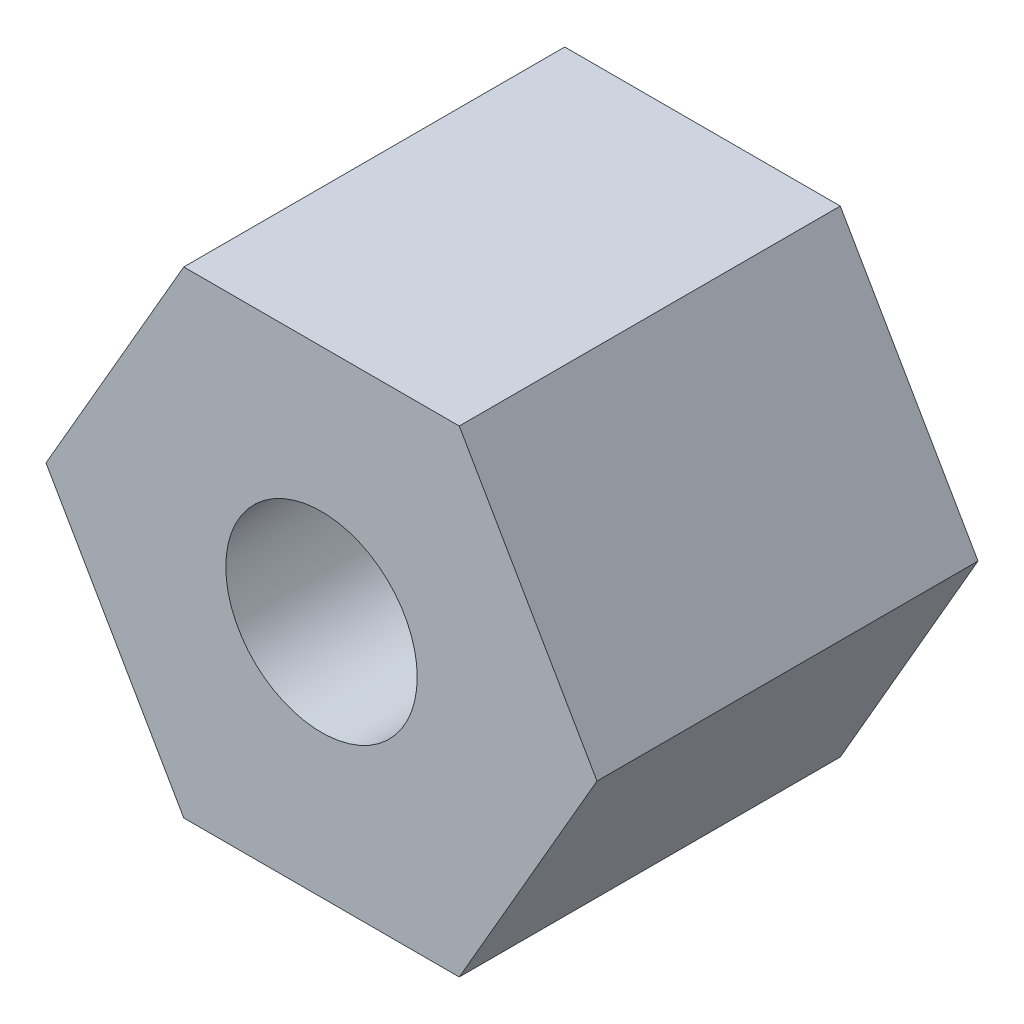
from build123d import *

# Parameters (mm, degrees)
SKETCH_1_R      = 10.05
EXTRUDE_1_DEPTH = 40


with BuildPart() as part:
    # 草图1 → 凸台-拉伸1 (new body)
    with BuildSketch(Plane.XY):
        Polygon((14.462624243, 25.05), (-14.462624243, 25.05), (-28.925248486, 0), (-14.462624243, -25.05), (14.462624243, -25.05), (28.925248486, 0), align=None)
        Circle(SKETCH_1_R, mode=Mode.SUBTRACT)
    extrude(amount=EXTRUDE_1_DEPTH)


solid = part.part
